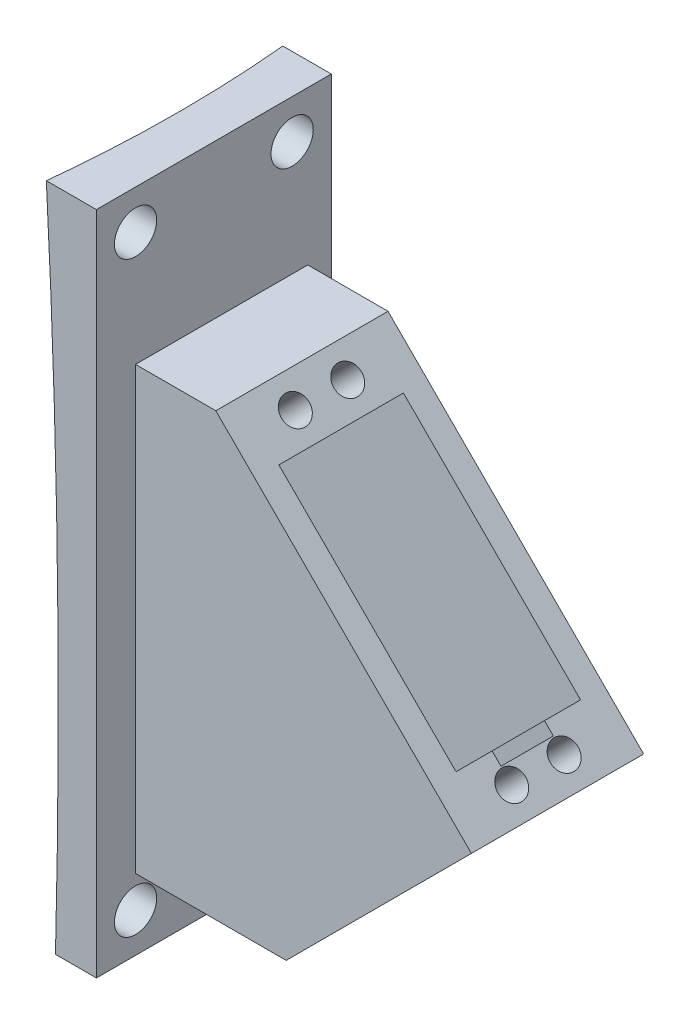
from build123d import *

# Parameters (mm, degrees)
SKETCH1_W               = 15.24
SKETCH1_H               = 47.25
BOSS_EXTRUDE1_DEPTH     = 29
BOSS_EXTRUDE2_DEPTH     = 15.24
BOSS_EXTRUDE3_START     = 6.35
BOSS_EXTRUDE3_DEPTH     = 27.94
CUT_EXTRUDE4_DEPTH      = 90.856122335
CUT_EXTRUDE4_DEPTH_BACK = 90.856122335
BOSS_EXTRUDE4_START     = 12.7
SKETCH15_W              = 12.73404056
SKETCH15_H              = 107.95
BOSS_EXTRUDE4_DEPTH     = 38.1
SKETCH17_R              = 3.429
CUT_EXTRUDE6_DEPTH      = 95.762638832
BOSS_EXTRUDE9_DEPTH     = 6.35
BOSS_EXTRUDE10_DEPTH    = 6.35
SKETCH12_W              = 20.20062
SKETCH12_H              = 40.64
CUT_EXTRUDE8_DEPTH      = 38.1
SKETCH21_W              = 27.94
SKETCH21_H              = 50.342193805
CUT_EXTRUDE9_DEPTH      = 8
SKETCH22_W              = 27.94
SKETCH22_H              = 8
CUT_EXTRUDE10_DEPTH     = 2.54
BOSS_EXTRUDE11_DEPTH    = 13.97
SKETCH24_W              = 11.491520074
SKETCH24_H              = 20.20062
CUT_EXTRUDE11_DEPTH     = 112.502999945
SKETCH25_R              = 2.249999945
CUT_EXTRUDE12_DEPTH     = 18
CUT_EXTRUDE13_REACH     = 83.705
SKETCH26_W              = 8.500000018
SKETCH26_H              = 2.032


with BuildPart() as part:
    # Sketch1 → Boss-Extrude1 (new body)
    with BuildSketch(Plane(origin=(0, 0, 0), x_dir=(0, 0, -1), z_dir=(1, 0, 0))):
        Rectangle(SKETCH1_W, SKETCH1_H)
    extrude(amount=BOSS_EXTRUDE1_DEPTH)

    # Sketch8 → Cut-Revolve1 (revolve, cut)
    with BuildSketch(Plane(origin=(0, 0, 0), x_dir=(1, 0, 0), z_dir=(0, 1, 0))):
        with BuildLine():
            Line((-1363.98, 509.27), (-1363.98, -509.27))
            add(Edge.make_bspline(
                [(-1363.98, -509.27), (8.89, -509.27), (8.89, 0), (8.89, 509.27), (-1363.98, 509.27)],
                knots=[4.71238898, 4.71238898, 4.71238898, 6.283185307, 6.283185307, 7.853981634, 7.853981634, 7.853981634], degree=2, weights=[1, 0.707106781, 1, 0.707106781, 1]))
        make_face()
    revolve(axis=Axis((-1363.98, 0, -509.27), (0, 0, 1)), mode=Mode.SUBTRACT)

    # Sketch9 → Boss-Extrude2 (add)
    with BuildSketch(Plane.XY.offset(7.62)):
        Polygon((29, -23.625), (57.293684645, -23.625), (29, 23.625), align=None)
    extrude(amount=-BOSS_EXTRUDE2_DEPTH)

    # Sketch11 → Boss-Extrude3 (add)
    with BuildSketch(Plane(origin=(0, 0, -7.62), x_dir=(-1, 0, 0), z_dir=(0, 0, -1)).offset(BOSS_EXTRUDE3_START)):
        Polygon((-8.532999942, 23.625), (-35.473768305, 50.565768363), (-71.071074924, 14.968461744), (-48.544371121, -9.013786608), (-28.889356272, 23.625), align=None)
    extrude(amount=-BOSS_EXTRUDE3_DEPTH)

    # Sketch13 → Cut-Extrude4 (cut, two sides: drawn at the far end of the back side and taken through both)
    with BuildSketch(Plane(origin=(0, 0, -7.62), x_dir=(-1, 0, 0), z_dir=(0, 0, -1)).offset(-CUT_EXTRUDE4_DEPTH_BACK)):
        Polygon((-61.672265147, 5.569651967), (-8.532999942, -23.625), (-25.02523354, -53.6436889), (-79.417056311, -23.760883228), align=None)
    extrude(amount=CUT_EXTRUDE4_DEPTH + CUT_EXTRUDE4_DEPTH_BACK, mode=Mode.SUBTRACT)

    # Sketch15 → Boss-Extrude4 (add)
    with BuildSketch(Plane.XY.offset(7.62).offset(BOSS_EXTRUDE4_START)):
        with Locations((7.499979662, 18.790026662)):
            Rectangle(SKETCH15_W, SKETCH15_H)
    extrude(amount=-BOSS_EXTRUDE4_DEPTH)

    # Sketch16 → Cut-Revolve2 (revolve, cut)
    with BuildSketch(Plane(origin=(0, 0, 0), x_dir=(1, 0, 0), z_dir=(0, 1, 0))):
        with BuildLine():
            Line((-1364.099005706, 509.27), (-1364.099005706, -509.27))
            add(Edge.make_bspline(
                [(-1364.099005706, -509.27), (8.770994294, -509.27), (8.770994294, 0), (8.770994294, 509.27), (-1364.099005706, 509.27)],
                knots=[4.71238898, 4.71238898, 4.71238898, 6.283185307, 6.283185307, 7.853981634, 7.853981634, 7.853981634], degree=2, weights=[1, 0.707106781, 1, 0.707106781, 1]))
        make_face()
    revolve(axis=Axis((-1364.099005706, 0, -509.27), (0, 0, 1)), mode=Mode.SUBTRACT)

    # Sketch17 → Cut-Extrude6 (cut, through all)
    with BuildSketch(Plane(origin=(13.866999942, 0, 0), x_dir=(0, 0, -1), z_dir=(1, 0, 0))):
        with Locations(Location((-13.97, -28.834973338, 0), (0, 0, 90))):
            Circle(SKETCH17_R)
        with Locations(Location((-13.97, 66.415026662, 0), (0, 0, 90))):
            Circle(SKETCH17_R)
        with Locations(Location((11.43, 66.415026662, 0), (0, 0, 90))):
            Circle(SKETCH17_R)
        with Locations(Location((11.43, -28.834973338, 0), (0, 0, 90))):
            Circle(SKETCH17_R)
    extrude(amount=-CUT_EXTRUDE6_DEPTH, mode=Mode.SUBTRACT)

    # Sketch19 → Boss-Extrude9 (add)
    with BuildSketch(Plane.XY.offset(7.62)):
        Polygon((13.866999942, 23.625), (13.866999942, -20.694506456), (45.209055073, -3.475216955), (28.889356272, 23.625), align=None)
    extrude(amount=BOSS_EXTRUDE9_DEPTH)

    # Sketch20 → Boss-Extrude10 (add)
    with BuildSketch(Plane(origin=(0, 0, -7.62), x_dir=(-1, 0, 0), z_dir=(0, 0, -1))):
        Polygon((-45.209055073, -3.475216955), (-13.866999942, -20.694506456), (-13.866999942, 23.625), (-28.889356272, 23.625), align=None)
    extrude(amount=BOSS_EXTRUDE10_DEPTH)

    # Sketch12 → Cut-Extrude8 (cut)
    with BuildSketch(Plane(origin=(43.019768334, 43.019768334, 0), x_dir=(0, 0, -1), z_dir=(0.7071067811865476, 0.7071067811865476, 0))):
        with Locations((0, -14.49944132)):
            Rectangle(SKETCH12_W, SKETCH12_H)
    extrude(amount=-CUT_EXTRUDE8_DEPTH, mode=Mode.SUBTRACT)

    # Sketch21 → Cut-Extrude9 (cut)
    with BuildSketch(Plane(origin=(43.019768334, 43.019768334, 0), x_dir=(0, 0, -1), z_dir=(0.7071067811865477, 0.7071067811865475, 0))):
        with Locations((0, -14.49944132)):
            Rectangle(SKETCH21_W, SKETCH21_H)
    extrude(amount=-CUT_EXTRUDE9_DEPTH, mode=Mode.SUBTRACT)

    # Sketch22 → Cut-Extrude10 (cut)
    with BuildSketch(Plane(origin=(28.05130659, -28.05130659, 0), x_dir=(0, 0, 1), z_dir=(-0.7071067811865476, 0.7071067811865476, 0))):
        with Locations((0, 56.839139829)):
            Rectangle(SKETCH22_W, SKETCH22_H)
    extrude(amount=-CUT_EXTRUDE10_DEPTH, mode=Mode.SUBTRACT)

    # Sketch23 → Boss-Extrude11 (add, symmetric)
    with BuildSketch(Plane.XY):
        Polygon((29.816914056, 44.908914114), (26.883196541, 47.842631629), (13.866999942, 47.842631629), (13.866999942, 28.959), align=None)
        Polygon((65.591257632, 9.134570538), (13.866999942, -20.694506456), (13.866999942, -23.674292513), (38.295755697, -23.674292513), (68.34793819, 6.37788998), align=None)
    extrude(amount=BOSS_EXTRUDE11_DEPTH, both=True)

    # Sketch24 → Cut-Extrude11 (cut, through all)
    with BuildSketch(Plane(origin=(12.416727049, -21.530870355, 0), x_dir=(0.8662714122168664, 0.49957365860881403, 0), z_dir=(-0.49957365860881403, 0.8662714122168664, 0))):
        with Locations((35.963054904, 0)):
            Rectangle(SKETCH24_W, SKETCH24_H)
    extrude(amount=-CUT_EXTRUDE11_DEPTH, mode=Mode.SUBTRACT)

    # Sketch25 → Cut-Extrude12 (cut)
    with BuildSketch(Plane(origin=(37.362914085, 37.362914085, 0), x_dir=(0, 0, -1), z_dir=(0.7071067811865476, 0.7071067811865475, 0))):
        with Locations(Location((-4.250000009, 10.32055868, 0), (0, 0, 90))):
            Circle(SKETCH25_R)
        with Locations(Location((4.250000009, 10.32055868, 0), (0, 0, 90))):
            Circle(SKETCH25_R)
        with Locations(Location((-4.250000009, -39.31944132, 0), (0, 0, 90))):
            Circle(SKETCH25_R)
        with Locations(Location((4.250000009, -39.31944132, 0), (0, 0, 90))):
            Circle(SKETCH25_R)
    extrude(amount=-CUT_EXTRUDE12_DEPTH, mode=Mode.SUBTRACT)

    # Cut-Extrude13: up to this plane
    cut_extrude13_end = Plane(origin=(68.733790735, -35.697044307, 10.10031), z_dir=(0.8662714122168665, 0.49957365860881403, -3.0669196206838748e-15))
    # Sketch26 → Cut-Extrude13 (cut, up to the surface)
    with BuildSketch(Plane(origin=(37.362914085, 37.362914085, 0), x_dir=(0, 0, -1), z_dir=(0.7071067811865476, 0.7071067811865475, 0)), mode=Mode.PRIVATE) as cut_extrude13_sk1:
        with Locations((0, -35.83544132)):
            Rectangle(SKETCH26_W, SKETCH26_H)
    cut_extrude13_tool1 = split(extrude(cut_extrude13_sk1.sketch, amount=-CUT_EXTRUDE13_REACH, mode=Mode.PRIVATE), bisect_by=cut_extrude13_end, keep=Keep.BOTH, mode=Mode.PRIVATE)
    add(cut_extrude13_tool1.solids().sort_by_distance((62.702398, 12.023431, 0))[0], mode=Mode.SUBTRACT)


solid = part.part
